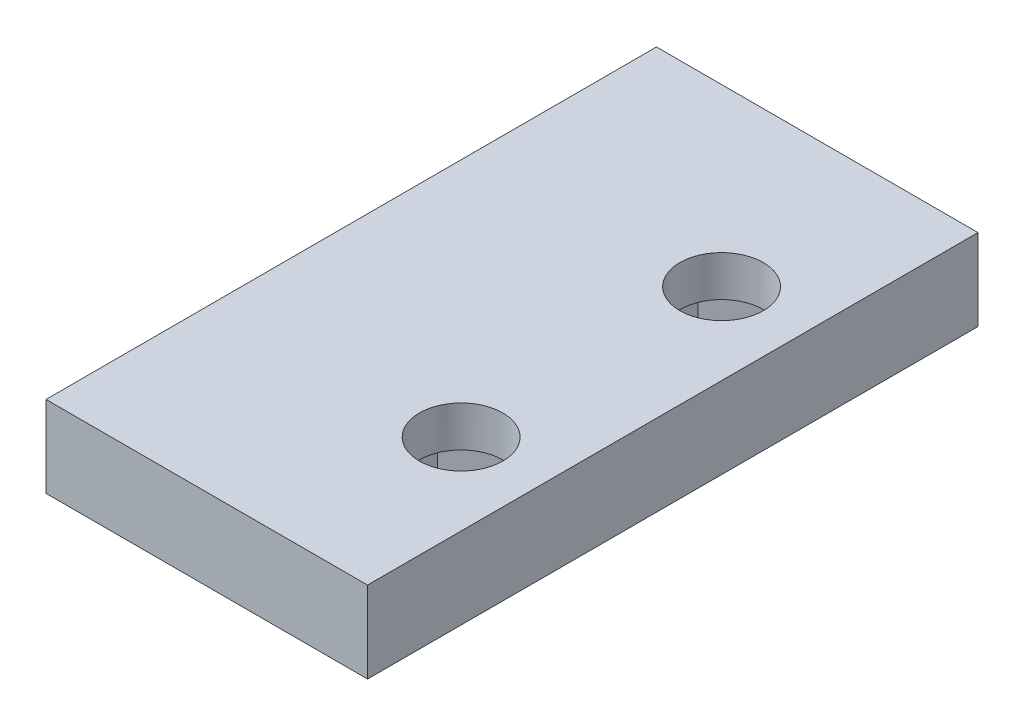
from build123d import *

# Parameters (mm, degrees)
SKETCH_1_W          = 15.8
SKETCH_1_H          = 30
EXTRUDE_1_DEPTH     = 4
SKETCH_2_R          = 2.05
CUT_EXTRUDE_1_DEPTH = 35.141470384
CUT_EXTRUDE_2_DEPTH = 2


with BuildPart() as part:
    # 草图1 → 凸台-拉伸1 (new body)
    with BuildSketch(Plane(origin=(0, 0, 0), x_dir=(1, 0, 0), z_dir=(0, 1, 0))):
        with Locations((7.9, 15)):
            Rectangle(SKETCH_1_W, SKETCH_1_H)
    extrude(amount=EXTRUDE_1_DEPTH)

    # 草图2 → 切除-拉伸1 (cut, through all)
    with BuildSketch(Plane(origin=(0, 4, 0), x_dir=(1, 0, 0), z_dir=(0, 1, 0))):
        with Locations((11.8, 21.4)):
            Circle(SKETCH_2_R)
        with Locations((11.8, 8.6)):
            Circle(SKETCH_2_R)
    extrude(amount=-CUT_EXTRUDE_1_DEPTH, mode=Mode.SUBTRACT)

    # 草图5 → 切除-拉伸2 (cut)
    with BuildSketch(Plane.XZ):
        Polygon((14.55, -7.01228676), (11.8, -5.424573519), (9.05, -7.01228676), (9.05, -10.18771324), (11.8, -11.775426481), (14.55, -10.18771324), align=None)
        Polygon((9.05, -22.98771324), (11.8, -24.575426481), (14.55, -22.98771324), (14.55, -19.81228676), (11.8, -18.224573519), (9.05, -19.81228676), align=None)
    extrude(amount=-CUT_EXTRUDE_2_DEPTH, mode=Mode.SUBTRACT)


solid = part.part
